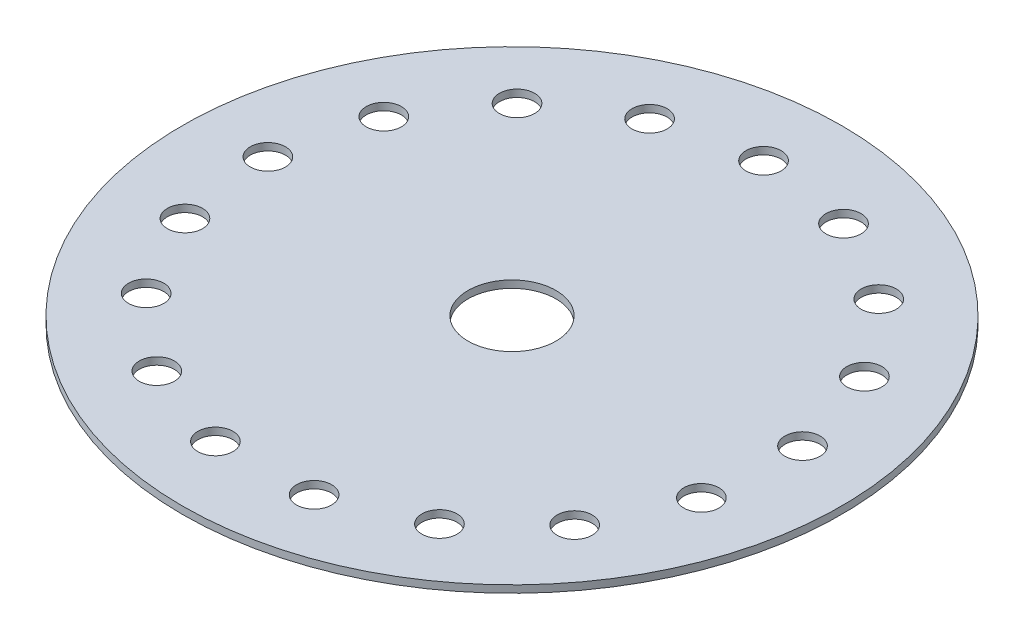
from build123d import *

# Parameters (mm, degrees)
SKETCH_1_R          = 90
EXTRUDE_1_DEPTH     = 2
SKETCH_2_R          = 4.8
SKETCH_2_R_2        = 12
CUT_EXTRUDE_3_DEPTH = 128.294933128


with BuildPart() as part:
    # Эскиз1 → Вытянуть1 (new body)
    with BuildSketch(Plane(origin=(0, 0, 0), x_dir=(1, 0, 0), z_dir=(0, 1, 0))):
        with Locations(Location((0, 0, 0), (0, 0, 270))):
            Circle(SKETCH_1_R)
    extrude(amount=EXTRUDE_1_DEPTH)

    # Эскиз2 → Вырез-Вытянуть3 (cut, through all)
    with BuildSketch(Plane(origin=(0, 0, 0), x_dir=(1, 0, 0), z_dir=(0, 1, 0))):
        with Locations(Location((68.925113062, -17.208935516, 0), (0, 0, 270))):
            Circle(SKETCH_2_R)
        with Locations(Location((58.0541693, -40.945477151, 0), (0, 0, 270))):
            Circle(SKETCH_2_R)
        with Locations(Location((39.342688284, -59.15210521, 0), (0, 0, 270))):
            Circle(SKETCH_2_R)
        with Locations(Location((15.317759211, -69.369913687, 0), (0, 0, 270))):
            Circle(SKETCH_2_R)
        with Locations(Location((-10.775918123, -70.218930929, 0), (0, 0, 270))):
            Circle(SKETCH_2_R)
        with Locations(Location((-35.414248003, -61.584492452, 0), (0, 0, 270))):
            Circle(SKETCH_2_R)
        with Locations(Location((-55.269687452, -44.632727018, 0), (0, 0, 270))):
            Circle(SKETCH_2_R)
        with Locations(Location((-67.660649352, -21.653064482, 0), (0, 0, 270))):
            Circle(SKETCH_2_R)
        with Locations(Location((-70.913665636, 4.250964396, 0), (0, 0, 270))):
            Circle(SKETCH_2_R)
        with Locations(Location((-64.589398429, 29.580876977, 0), (0, 0, 270))):
            Circle(SKETCH_2_R)
        with Locations(Location((-49.541975063, 50.915728209, 0), (0, 0, 270))):
            Circle(SKETCH_2_R)
        with Locations(Location((-27.803633442, 65.374128213, 0), (0, 0, 270))):
            Circle(SKETCH_2_R)
        with Locations(Location((-2.31025706, 71.003389951, 0), (0, 0, 270))):
            Circle(SKETCH_2_R)
        with Locations(Location((23.495132339, 67.043250433, 0), (0, 0, 270))):
            Circle(SKETCH_2_R)
        with Locations(Location((46.127373925, 54.028548444, 0), (0, 0, 270))):
            Circle(SKETCH_2_R)
        with Locations(Location((62.529858062, 33.716991605, 0), (0, 0, 270))):
            Circle(SKETCH_2_R)
        with Locations(Location((70.487338378, 8.851768218, 0), (0, 0, 270))):
            Circle(SKETCH_2_R)
        with Locations(Location((0, 0, 0), (0, 0, 270))):
            Circle(SKETCH_2_R_2)
    extrude(amount=CUT_EXTRUDE_3_DEPTH, mode=Mode.SUBTRACT)


solid = part.part
